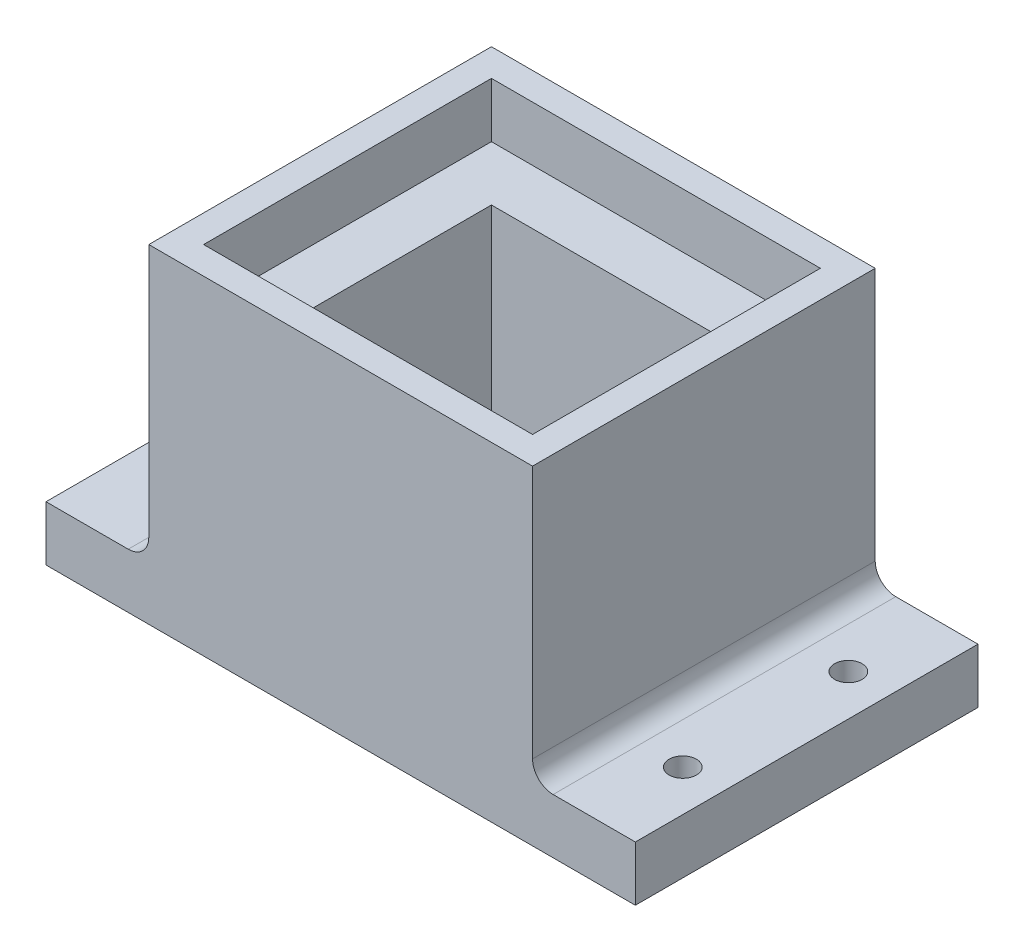
from build123d import *

# Parameters (mm, degrees)
SKETCH1_W               = 56
SKETCH1_H               = 50
BOSS_EXTRUDE1_DEPTH     = 48
SKETCH3_W               = 48
SKETCH3_H               = 42
CUT_EXTRUDE1_DEPTH      = 8
SKETCH4_W               = 15
SKETCH4_H               = 8
BOSS_EXTRUDE2_DEPTH     = 50
FILLET1_R               = 3
CUT_EXTRUDE2_DEPTH      = 64.827893589
CUT_EXTRUDE2_DEPTH_BACK = 64.827893589
SKETCH5_W               = 32
SKETCH5_H               = 26
CUT_EXTRUDE3_DEPTH      = 64.827893589
CUT_EXTRUDE3_DEPTH_BACK = 64.827893589
SKETCH6_R               = 2


with BuildPart() as part:
    # Sketch1 → Boss-Extrude1 (new body)
    with BuildSketch(Plane(origin=(0, 0, 0), x_dir=(1, 0, 0), z_dir=(0, 1, 0))):
        Rectangle(SKETCH1_W, SKETCH1_H)
    extrude(amount=BOSS_EXTRUDE1_DEPTH)

    # Sketch3 → Cut-Extrude1 (cut)
    with BuildSketch(Plane(origin=(0, 48, 0), x_dir=(1, 0, 0), z_dir=(0, 1, 0))):
        Rectangle(SKETCH3_W, SKETCH3_H)
    extrude(amount=-CUT_EXTRUDE1_DEPTH, mode=Mode.SUBTRACT)

    # Sketch4 → Boss-Extrude2 (add)
    with BuildSketch(Plane.XY.offset(25)):
        with Locations((-35.5, 4)):
            Rectangle(SKETCH4_W, SKETCH4_H)
        with Locations((35.5, 4)):
            Rectangle(SKETCH4_W, SKETCH4_H)
    extrude(amount=-BOSS_EXTRUDE2_DEPTH)

    # Fillet1
    fillet1_edges = [part.edges().sort_by_distance(p)[0] for p in [
        (-28, 8, 0),
        (28, 8, 0),
    ]]
    fillet(fillet1_edges, radius=FILLET1_R)

    # Sketch5 → Cut-Extrude2 (cut, two sides: drawn at the far end of the back side and taken through both)
    with BuildSketch(Plane(origin=(0, 40, 0), x_dir=(1, 0, 0), z_dir=(0, 1, 0)).offset(-CUT_EXTRUDE2_DEPTH_BACK)):
        Rectangle(SKETCH5_W, SKETCH5_H)
    extrude(amount=CUT_EXTRUDE2_DEPTH + CUT_EXTRUDE2_DEPTH_BACK, mode=Mode.SUBTRACT)

    # Sketch6 → Cut-Extrude3 (cut, two sides: drawn at the far end of the back side and taken through both)
    with BuildSketch(Plane(origin=(0, 8, 0), x_dir=(1, 0, 0), z_dir=(0, 1, 0)).offset(-CUT_EXTRUDE3_DEPTH_BACK)):
        with Locations(Location((-37, 12.079385962, 0), (0, 0, 180))):
            Circle(SKETCH6_R)
        with Locations(Location((-37, -12.079385962, 0), (0, 0, 180))):
            Circle(SKETCH6_R)
        with Locations((37, -12.079385962)):
            Circle(SKETCH6_R)
        with Locations((37, 12.079385962)):
            Circle(SKETCH6_R)
    extrude(amount=CUT_EXTRUDE3_DEPTH + CUT_EXTRUDE3_DEPTH_BACK, mode=Mode.SUBTRACT)


solid = part.part
